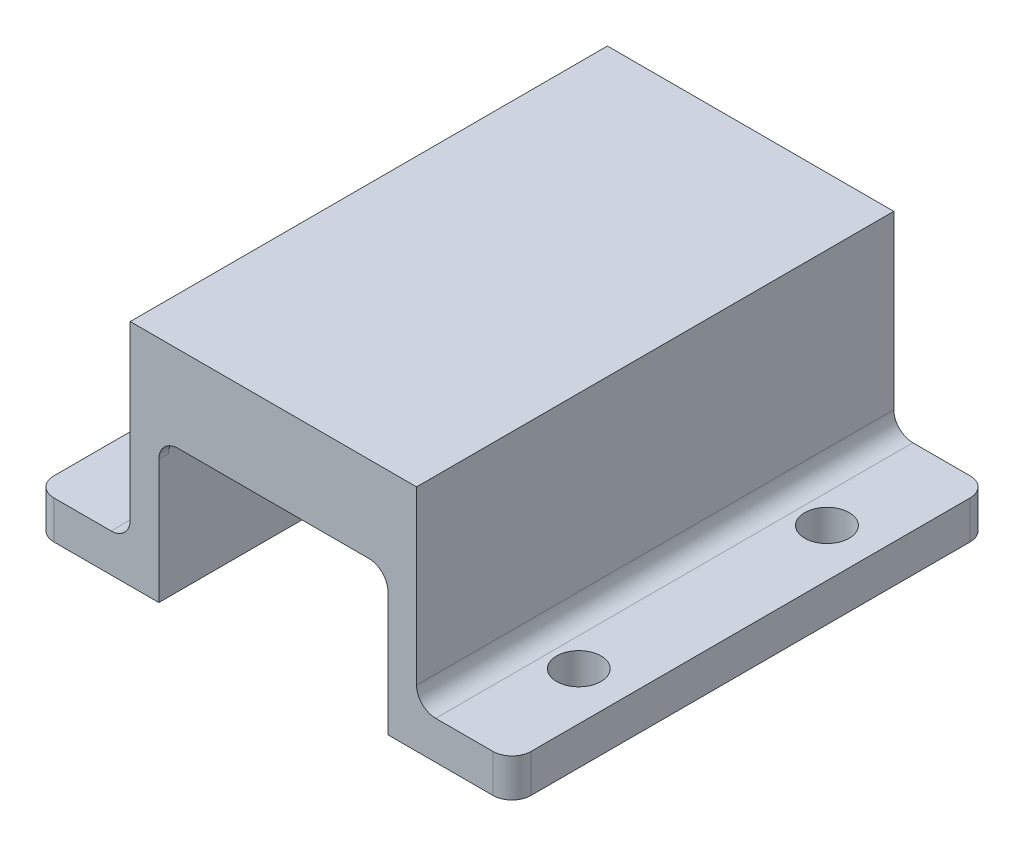
from build123d import *

# Parameters (mm, degrees)
SKETCH1_W               = 15
SKETCH1_H               = 12
BOSS_EXTRUDE1_DEPTH     = 30
SKETCH3_W               = 12
SKETCH3_H               = 10
CUT_EXTRUDE1_DEPTH      = 30
FILLET1_R               = 1
SKETCH4_W               = 12
SKETCH4_H               = 0.5
BOSS_EXTRUDE3_DEPTH     = 2.5
CUT_EXTRUDE2_DEPTH      = 36.623026261
CUT_EXTRUDE2_DEPTH_BACK = 36.623026261
SKETCH5_W               = 15
SKETCH5_H               = 5
SKETCH6_W               = 5
SKETCH6_H               = 25
SKETCH6_R               = 1.162975042
SKETCH6_R_2             = 1.164851314
BOSS_EXTRUDE4_DEPTH     = 2
FILLET2_R               = 1


with BuildPart() as part:
    # Sketch1 → Boss-Extrude1 (new body)
    with BuildSketch(Plane.XY):
        with Locations((7.5, 6)):
            Rectangle(SKETCH1_W, SKETCH1_H)
    extrude(amount=BOSS_EXTRUDE1_DEPTH)

    # Sketch3 → Cut-Extrude1 (cut)
    with BuildSketch(Plane.XY.offset(30)):
        with Locations((7.5, 5)):
            Rectangle(SKETCH3_W, SKETCH3_H)
    extrude(amount=-CUT_EXTRUDE1_DEPTH, mode=Mode.SUBTRACT)

    # Fillet1
    fillet1_edges = [part.edges().sort_by_distance(p)[0] for p in [
        (1.5, 10, 15),
        (13.5, 10, 15),
    ]]
    fillet(fillet1_edges, radius=FILLET1_R)

    # Sketch4 → Boss-Extrude3 (add)
    with BuildSketch(Plane.XZ.offset(-10)):
        with Locations((7.5, 29.75)):
            Rectangle(SKETCH4_W, SKETCH4_H)
        with Locations((7.5, 5.25)):
            Rectangle(SKETCH4_W, SKETCH4_H)
    extrude(amount=BOSS_EXTRUDE3_DEPTH)

    # Sketch5 → Cut-Extrude2 (cut, two sides: drawn at the far end of the back side and taken through both)
    with BuildSketch(Plane.XZ.offset(-CUT_EXTRUDE2_DEPTH_BACK)):
        with Locations((7.5, 2.5)):
            Rectangle(SKETCH5_W, SKETCH5_H)
    extrude(amount=CUT_EXTRUDE2_DEPTH + CUT_EXTRUDE2_DEPTH_BACK, mode=Mode.SUBTRACT)

    # Sketch6 → Boss-Extrude4 (add)
    # profile 1 of 2: a face of its own
    with BuildSketch(Plane.XZ):
        with Locations((17.5, 17.5)):
            Rectangle(SKETCH6_W, SKETCH6_H)
        with Locations(Location((17.5, 24, 0), (0, 0, 270))):
            Circle(SKETCH6_R, mode=Mode.SUBTRACT)
        with Locations(Location((17.5, 11, 0), (0, 0, 270))):
            Circle(SKETCH6_R_2, mode=Mode.SUBTRACT)
    # profile 2 of 2: a face of its own
    with BuildSketch(Plane.XZ):
        with Locations((-2.5, 17.5)):
            Rectangle(SKETCH6_W, SKETCH6_H)
        with Locations(Location((-2.5, 11, 0), (0, 0, 90))):
            Circle(SKETCH6_R_2, mode=Mode.SUBTRACT)
        with Locations(Location((-2.5, 24, 0), (0, 0, 90))):
            Circle(SKETCH6_R, mode=Mode.SUBTRACT)
    extrude(amount=-BOSS_EXTRUDE4_DEPTH)

    # Fillet2
    fillet2_edges = [part.edges().sort_by_distance(p)[0] for p in [
        (15, 2, 17.5),
        (20, 1, 30),
        (20, 1, 5),
        (0, 2, 17.5),
        (-5, 1, 5),
        (-5, 1, 30),
        (13.5, 7.5, 29.75),
        (1.5, 7.5, 29.75),
        (13.5, 7.5, 5.25),
        (1.5, 7.5, 5.25),
    ]]
    fillet(fillet2_edges, radius=FILLET2_R)


solid = part.part
